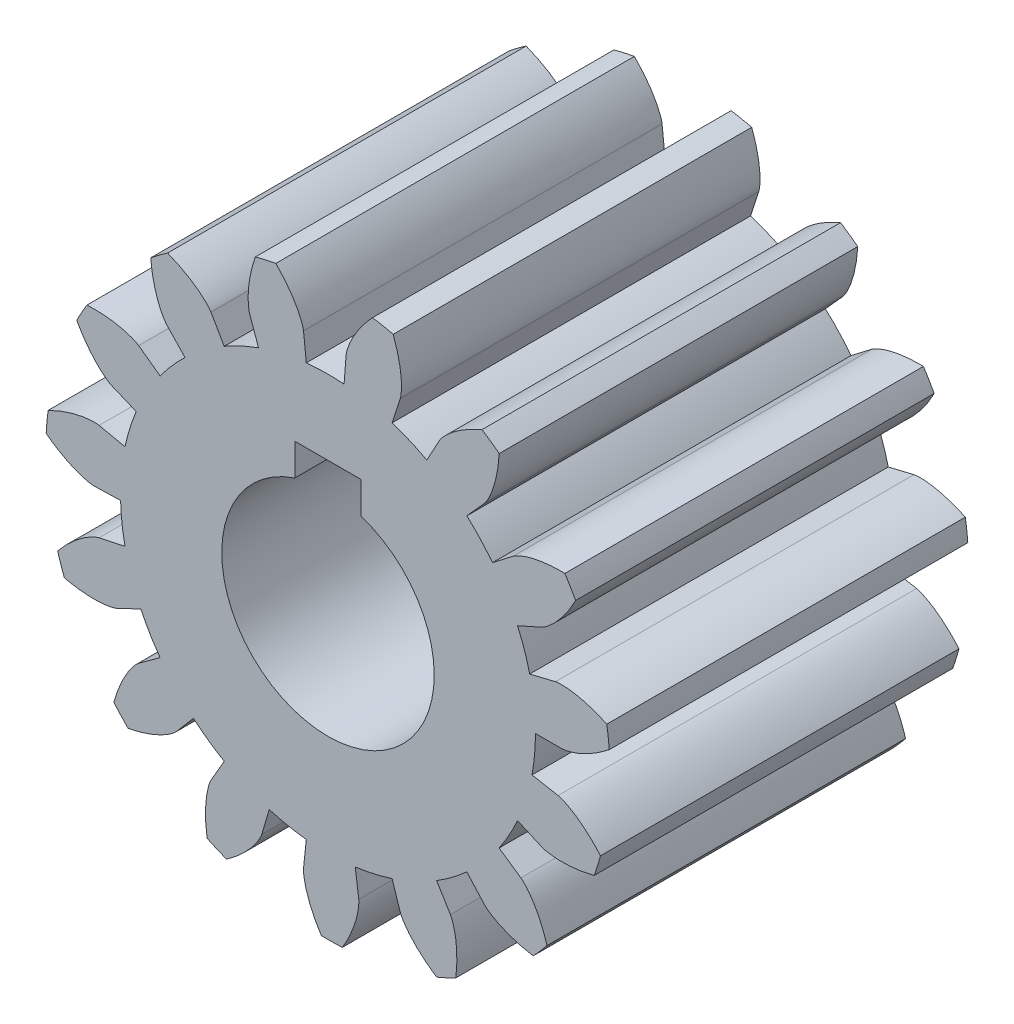
from build123d import *

# Parameters (mm, degrees)
SKETCH3_W          = 28.8045
SKETCH3_H          = 54
SKETCH7_R          = 52.376252078
SKETCH7_R_2        = 42.5
CUT_EXTRUDE2_DEPTH = 84.251945566
CUT_EXTRUDE1_DEPTH = 81.799133659
CIRPATTERN4_COUNT  = 15
SKETCH8_W          = 10
SKETCH8_H          = 20
CUT_EXTRUDE3_DEPTH = 81.766742973


with BuildPart() as part:
    # Sketch3 → Revolve1 (revolve)
    with BuildSketch(Plane.XZ):
        with Locations((30.40225, 27)):
            Rectangle(SKETCH3_W, SKETCH3_H)
    revolve(axis=Axis((0, 0, 54), (0, 0, -1)))

    # Sketch7 → Cut-Extrude2 (cut, through all)
    with BuildSketch(Plane.XY.offset(54)):
        Circle(SKETCH7_R)
        Circle(SKETCH7_R_2, mode=Mode.SUBTRACT)
    extrude(amount=-CUT_EXTRUDE2_DEPTH, mode=Mode.SUBTRACT)

    # Sketch6 → Cut-Extrude1 (cut, through all)
    with BuildSketch(Plane.XY.offset(54)):
        with BuildLine():
            Line((35.238473279, 0), (31.25, 0))
            ThreePointArc((31.25, 0), (31.120297984, -2.844214021), (30.732268582, -5.664818424))
            Line((30.732268582, -5.664818424), (34.654663208, -6.387825685))
            add(Edge.make_bspline(
                [(34.654663208, -6.387825685), (34.680183794, -6.393089162), (34.751396814, -6.409526123), (34.884507208, -6.447156997), (35.099073267, -6.517781145), (35.491566383, -6.668524699), (36.071417819, -6.937054689), (36.688350544, -7.281698453), (37.319666017, -7.688865347), (37.859173876, -8.074435033), (38.280342208, -8.396947672), (38.779063087, -8.80390882), (39.361836136, -9.316866266), (40.017447829, -9.946803503), (40.732907649, -10.703917428), (41.42556869, -11.507951143), (42.082860073, -12.340676933), (42.705999966, -13.199906518), (43.221520379, -13.971320669), (43.643398466, -14.647002961), (44.048176394, -15.330184641), (44.373817092, -15.911310263), (44.683071616, -16.491678287), (44.984500198, -17.09123044), (45.210255578, -17.555886548), (45.443264107, -18.060508808), (45.641835906, -18.502896419), (45.821914479, -18.926958068), (45.915411582, -19.151866667), (45.961074996, -19.263426055)],
                knots=[0, 0, 0, 0, 0, 0.005376748, 0.015083688, 0.02853182, 0.046610139, 0.092110525, 0.146842495, 0.174208853, 0.201574955, 0.228941013, 0.256307345, 0.307035032, 0.361767351, 0.41649966, 0.471231936, 0.525964281, 0.580696615, 0.635428982, 0.662795184, 0.690161387, 0.744893688, 0.772259885, 0.799626083, 0.826992246, 0.854358408, 0.881724662, 0.909090916, 0.909090916, 0.909090916, 0.909090916, 0.909090916], degree=4))
            ThreePointArc((45.961074996, -19.263426055), (49.627889564, -4.535700121), (48.691581182, 10.612724445))
            add(Edge.make_bspline(
                [(35.238473279, 0), (35.264525188, 0.000550051), (35.33753799, 0.003805612), (35.475264596, 0.016683561), (35.699078187, 0.047242362), (36.112394626, 0.124339615), (36.731316985, 0.283308661), (37.400503755, 0.510408591), (38.095168817, 0.796388586), (38.695632262, 1.077771533), (39.168286145, 1.318594026), (39.732516066, 1.628407661), (40.398620023, 2.02722502), (41.157561293, 2.527880354), (41.998413013, 3.142756466), (42.825349018, 3.80790786), (43.622702481, 4.507687582), (44.391274709, 5.239722782), (45.038091762, 5.904906058), (45.575464183, 6.492918439), (46.097379197, 7.09140578), (46.522967949, 7.603873405), (46.932304671, 8.118566374), (47.337422695, 8.653544282), (47.643668053, 9.06957862), (47.964291227, 9.523602166), (48.239766662, 9.92266462), (48.493733232, 10.307057071), (48.626451455, 10.511290905), (48.691581182, 10.612724445)],
                knots=[0, 0, 0, 0, 0, 0.005376748, 0.015083688, 0.02853182, 0.046610139, 0.092110525, 0.146842495, 0.174208853, 0.201574955, 0.228941013, 0.256307345, 0.307035032, 0.361767351, 0.41649966, 0.471231936, 0.525964281, 0.580696615, 0.635428982, 0.662795184, 0.690161387, 0.744893688, 0.772259885, 0.799626083, 0.826992246, 0.854358408, 0.881724662, 0.909090916, 0.909090916, 0.909090916, 0.909090916, 0.909090916], degree=4))
        make_face()
    cut_extrude1 = extrude(amount=-CUT_EXTRUDE1_DEPTH, mode=Mode.SUBTRACT)

    # CirPattern4: Cut-Extrude1 ×15 about axis
    cirpattern4_axis = Axis((0, 0, 54), (0, 0, -1))
    for i in range(1, CIRPATTERN4_COUNT):
        add(cut_extrude1.rotate(cirpattern4_axis, i * 360 / CIRPATTERN4_COUNT), mode=Mode.SUBTRACT)

    # Sketch8 → Cut-Extrude3 (cut, through all)
    with BuildSketch(Plane.XY.offset(54)):
        with Locations((0, 10)):
            Rectangle(SKETCH8_W, SKETCH8_H)
    extrude(amount=-CUT_EXTRUDE3_DEPTH, mode=Mode.SUBTRACT)


solid = part.part
